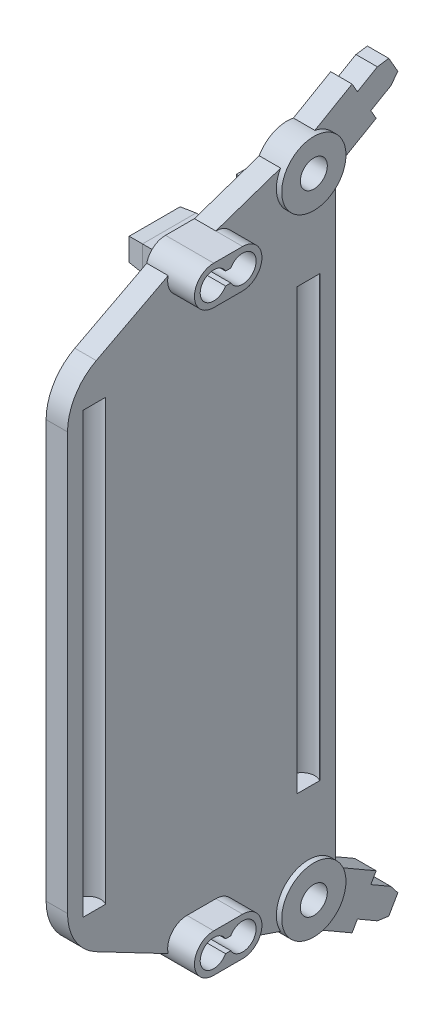
from build123d import *

# Parameters (mm, degrees)
DOWELSUPPORT_DEPTH          = 1.905
DOWELSUPPORT_DEPTH_BACK     = 1.27
SKETCH3_R                   = 3.81
SKETCH5_W                   = 6.35
SKETCH5_H                   = 57.15
SLIDERDOWELSUPPORT_DEPTH    = 1.27
SKETCH17_R                  = 1.549999948
SLIDERDOWELCUTOUT_DEPTH     = 26.035
CUT_EXTRUDE2_DEPTH          = 42.370444934
CUT_EXTRUDE2_DEPTH_BACK     = 42.370444934
SKETCH18_W                  = 1.27
SKETCH18_H                  = 38.1
LPATTERN1_COUNT             = 2
LPATTERN1_PITCH             = 25.4
LATERALSUPPORT_DEPTH        = 1.27
SKETCH8_W                   = 6.35
SKETCH8_H                   = 3
TABSUPPORT_DEPTH            = 1.27
STRINGDOWELSUPPORT_START    = -1.27
STRINGDOWELSUPPORT_DEPTH    = 5.715
INTERSUPPORT_DEPTH          = 1.27
SKETCH10_W                  = 6.35
SKETCH10_H                  = 3
TABBASE_DEPTH               = 1.27
SKETCH12_W                  = 6.35
SKETCH12_H                  = 3
TABDRAFT_DEPTH              = 1.73
TABDRAFT_DRAFT              = 5
TABDRAFT_PROFILE_2_DEPTH    = 1.73
TABDRAFT_PROFILE_2_DRAFT    = 5
STRINGDOWELHOLES_DEPTH      = 53.869299342
STRINGDOWELHOLES_DEPTH_BACK = 1.524
SKETCH14_R                  = 1.600000102
PULLEYDOWELHOLE_DEPTH       = 2.921
FILLET1_R                   = 6.35


with BuildPart() as part:
    # Sketch3 → DowelSupport (new, two sides: drawn at the far end of the back side and taken through both)
    with BuildSketch(Plane(origin=(0, 0, 0), x_dir=(0, 0, -1), z_dir=(1, 0, 0)).offset(-DOWELSUPPORT_DEPTH_BACK)):
        with Locations((0, 37.30625)):
            Circle(SKETCH3_R)
    extrude(amount=DOWELSUPPORT_DEPTH + DOWELSUPPORT_DEPTH_BACK)

    # Sketch8 → TabSupport (add, symmetric)
    with BuildSketch(Plane(origin=(0, 0, 0), x_dir=(0, 0, -1), z_dir=(1, 0, 0))):
        with Locations((0, 34.29)):
            Rectangle(SKETCH8_W, SKETCH8_H)
        with Locations((-12.7, 34.29)):
            Rectangle(SKETCH8_W, SKETCH8_H)
    extrude(amount=TABSUPPORT_DEPTH, both=True)


with BuildPart() as body_2:
    # Sketch5 → SliderDowelSupport (new, symmetric)
    with BuildSketch(Plane(origin=(0, 0, 0), x_dir=(0, 0, -1), z_dir=(1, 0, 0))):
        Rectangle(SKETCH5_W, SKETCH5_H)
    extrude(amount=SLIDERDOWELSUPPORT_DEPTH, both=True)

    # Sketch17 → SliderDowelCutout (cut, symmetric)
    with BuildSketch(Plane(origin=(0, 0, 0), x_dir=(1, 0, 0), z_dir=(0, 1, 0))):
        with BuildLine():
            Line((2.032000054, -1.350000094), (2.032000054, 0))
            ThreePointArc((2.032000054, 0), (1.82045896, -0.78168263), (1.243577144, -1.350000094))
            Line((1.243577144, -1.350000094), (2.032000054, -1.350000094))
        make_face()
        with BuildLine():
            Line((2.032000054, 0), (2.032000054, 1.350000094))
            Line((2.032000054, 1.350000094), (1.243577144, 1.350000094))
            ThreePointArc((1.243577144, 1.350000094), (1.82045896, 0.78168263), (2.032000054, 0))
        make_face()
        with Locations((0.482000106, 0)):
            Circle(SKETCH17_R)
    extrude(amount=SLIDERDOWELCUTOUT_DEPTH, both=True, mode=Mode.SUBTRACT)

    # Sketch18 → Cut-Extrude2 (cut, two sides: drawn at the far end of the back side and taken through both)
    with BuildSketch(Plane(origin=(1.27, 0, 0), x_dir=(0, 0, -1), z_dir=(1, 0, 0)).offset(-CUT_EXTRUDE2_DEPTH_BACK)):
        Rectangle(SKETCH18_W, SKETCH18_H)
    extrude(amount=CUT_EXTRUDE2_DEPTH + CUT_EXTRUDE2_DEPTH_BACK, mode=Mode.SUBTRACT)


with BuildPart() as lpattern1_1:
    # LPattern1: pattern copy
    add(body_2.part.moved(Location(Vector(0, 0, 1) * (1 * LPATTERN1_PITCH))))


with BuildPart() as body_4:
    # Sketch6 → LateralSupport (new, symmetric)
    with BuildSketch(Plane(origin=(0, 0, 0), x_dir=(0, 0, -1), z_dir=(1, 0, 0))):
        Polygon((7.392863577, 39.741434671), (5.805363577, 42.491065329), (8.169612929, 43.856065329), (9.523465192, 44.051124423), (10.602965192, 42.181375577), (9.757112929, 41.106434671), align=None)
    extrude(amount=LATERALSUPPORT_DEPTH, both=True)


with BuildPart() as tabsupport_piece_1:
    # of the separate pieces the step leaves, piece 1, a body of its own (tabsupport_pieces)
    add(part.part.solids().sort_by_distance((0, 37.30625, -3.81))[0])


with BuildPart() as tabsupport_piece_2:
    # of the separate pieces the step leaves, piece 2, a body of its own (tabsupport_pieces)
    add(part.part.solids().sort_by_distance((-1.27, 32.79, 9.525))[0])

    # Sketch15 → StringDowelSupport (add)
    with BuildSketch(Plane(origin=(0, 0, 0), x_dir=(0, 0, -1), z_dir=(1, 0, 0)).offset(STRINGDOWELSUPPORT_START)):
        with BuildLine():
            Line((-14.4145, 36.576), (-10.9855, 36.576))
            ThreePointArc((-10.9855, 36.576), (-8.6995, 34.29), (-10.9855, 32.004))
            Line((-10.9855, 32.004), (-14.4145, 32.004))
            ThreePointArc((-14.4145, 32.004), (-16.7005, 34.29), (-14.4145, 36.576))
        make_face()
    extrude(amount=STRINGDOWELSUPPORT_DEPTH)


with BuildPart() as body_2_1:
    add(body_2.part)

    add(lpattern1_1.part)  # InterSupport merges LPattern1_1

    add(body_4.part)  # InterSupport merges body 4

    add(tabsupport_piece_1.part)  # InterSupport merges TabSupport piece 1

    add(tabsupport_piece_2.part)  # InterSupport merges TabSupport piece 2
    # Sketch7 → InterSupport (add, symmetric)
    with BuildSketch(Plane(origin=(0, 0, 0), x_dir=(0, 0, -1), z_dir=(1, 0, 0))):
        Polygon((5.170363577, 43.590917591), (8.027863577, 38.641582409), (1.42875, 34.831582409), (-1.42875, 39.780917591), align=None)
        Polygon((-3.175, 22.225), (-3.175, 28.575), (3.175, 28.575), (3.175, 32.79), (0.923046602, 34.601940251), (-0.923046602, 40.010559749), (-10.9855, 36.576), (-14.4145, 36.576), (-15.109807039, 35.619115541), (-28.575, 28.575), (-22.225, 28.575), (-22.225, 0), (-3.175, 0), align=None)
    extrude(amount=INTERSUPPORT_DEPTH, both=True)

    # Sketch10 → TabBase (add)
    with BuildSketch(Plane.ZY.offset(1.27)):
        with Locations((0, 34.29)):
            Rectangle(SKETCH10_W, SKETCH10_H)
        with Locations((12.7, 34.29)):
            Rectangle(SKETCH10_W, SKETCH10_H)
    extrude(amount=TABBASE_DEPTH)


with BuildPart() as tabdraft_tool:
    # Sketch12 → TabDraft (with draft: the straight prism first)
    with BuildSketch(Plane.ZY.offset(2.54)):
        with Locations((0, 34.29)):
            Rectangle(SKETCH12_W, SKETCH12_H)
    extrude(amount=TABDRAFT_DEPTH)
    # TabDraft: the draft: its side faces are tilted about the plane it starts from
    tabdraft_sides = [tabdraft_tool.faces().sort_by_distance(p)[0] for p in [
        (-3.405, 34.29, 3.175),
        (-3.405, 35.79, 0),
        (-3.405, 34.29, -3.175),
        (-3.405, 32.79, 0),
    ]]
    draft(tabdraft_sides, Plane.ZY.offset(2.54), TABDRAFT_DRAFT)


with BuildPart() as body_2_2:
    add(body_2_1.part)

    # TabDraft: add tabdraft_tool
    add(tabdraft_tool.part)


with BuildPart() as tabdraft_profile_2_tool:
    # Sketch12 → TabDraft profile 2 (with draft: the straight prism first)
    with BuildSketch(Plane.ZY.offset(2.54)):
        with Locations((12.7, 34.29)):
            Rectangle(SKETCH12_W, SKETCH12_H)
    extrude(amount=TABDRAFT_PROFILE_2_DEPTH)
    # TabDraft profile 2: the draft: its side faces are tilted about the plane it starts from
    tabdraft_profile_2_sides = [tabdraft_profile_2_tool.faces().sort_by_distance(p)[0] for p in [
        (-3.405, 34.29, 9.525),
        (-3.405, 32.79, 12.7),
        (-3.405, 34.29, 15.875),
        (-3.405, 35.79, 12.7),
    ]]
    draft(tabdraft_profile_2_sides, Plane.ZY.offset(2.54), TABDRAFT_PROFILE_2_DRAFT)


with BuildPart() as body_2_3:
    add(body_2_2.part)

    # TabDraft profile 2: add tabdraft_profile_2_tool
    add(tabdraft_profile_2_tool.part)

    # Sketch16 → StringDowelHoles (cut, two sides: drawn at the far end of the back side and taken through both)
    with BuildSketch(Plane(origin=(1.905, 0, 0), x_dir=(0, 0, -1), z_dir=(1, 0, 0)).offset(-STRINGDOWELHOLES_DEPTH_BACK)):
        with BuildLine():
            Line((-13.00760401, 33.528), (-12.39239599, 33.528))
            ThreePointArc((-12.39239599, 33.528), (-9.385499898, 34.29), (-12.39239599, 35.052))
            Line((-12.39239599, 35.052), (-13.00760401, 35.052))
            ThreePointArc((-13.00760401, 35.052), (-16.014500102, 34.29), (-13.00760401, 33.528))
        make_face()
    extrude(amount=STRINGDOWELHOLES_DEPTH + STRINGDOWELHOLES_DEPTH_BACK, mode=Mode.SUBTRACT)

    # Sketch14 → PulleyDowelHole (cut)
    with BuildSketch(Plane(origin=(1.905, 0, 0), x_dir=(0, 0, -1), z_dir=(1, 0, 0))):
        with Locations((0, 37.30625)):
            Circle(SKETCH14_R)
    extrude(amount=-PULLEYDOWELHOLE_DEPTH, mode=Mode.SUBTRACT)

    # Mirror1: body 2 across plane


with BuildPart() as body_2_4:
    add(body_2_3.part)
    add(body_2_3.part.mirror(Plane.ZX))

    # Fillet1
    fillet1_edges = [body_2_4.edges().sort_by_distance(p)[0] for p in [
        (0, -28.575, 28.575),
        (0, 28.575, 28.575),
    ]]
    fillet(fillet1_edges, radius=FILLET1_R)


solid = body_2_4.part
